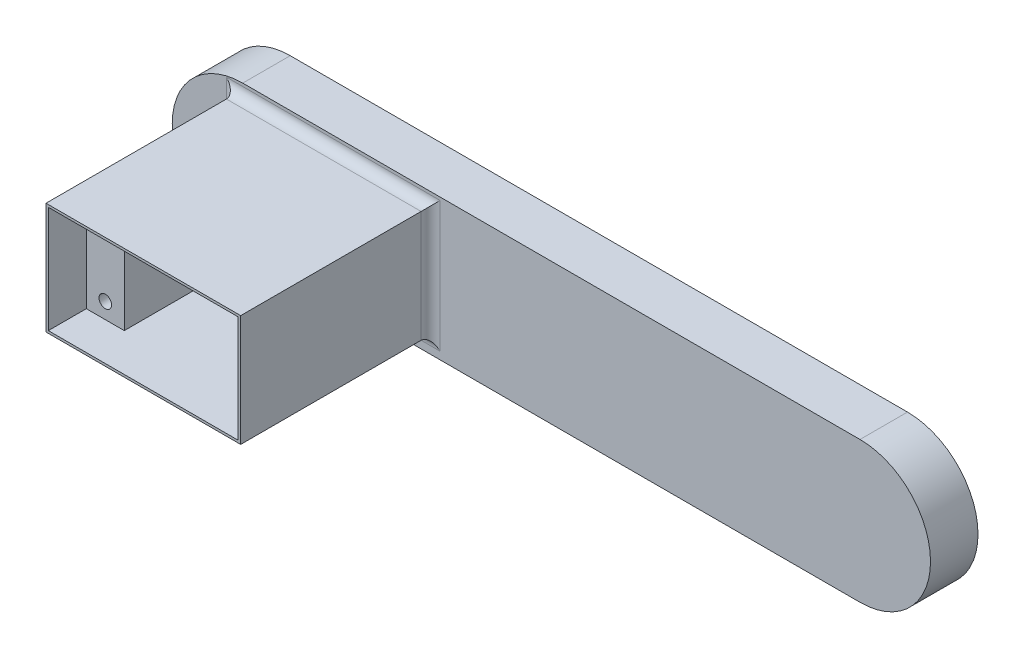
from build123d import *

# Parameters (mm, degrees)
BOSS_EXTRUDE1_DEPTH = 10
SKETCH2_R           = 3.25
CUT_EXTRUDE1_DEPTH  = 6
SKETCH3_W           = 41
SKETCH3_H           = 23.5
SKETCH3_W_2         = 40
SKETCH3_H_2         = 22.5
BOSS_EXTRUDE3_DEPTH = 40
SKETCH4_W           = 7.997138399
SKETCH4_H           = 22.5
SKETCH4_W_2         = 8.001104186
BOSS_EXTRUDE4_DEPTH = 32
SKETCH5_R           = 1.261769867
SKETCH5_R_2         = 1.301986765
SKETCH5_R_3         = 1.319264735
SKETCH5_R_4         = 1.310040981
CUT_EXTRUDE2_DEPTH  = 6
FILLET1_R           = 2


with BuildPart() as part:
    # Sketch1 → Boss-Extrude1 (new body)
    with BuildSketch(Plane.XY):
        with BuildLine():
            Line((-63.656716418, 10.820895522), (66.343283582, 10.820895522))
            ThreePointArc((66.343283582, 10.820895522), (81.194029851, -4.029850746), (66.343283582, -18.880597015))
            Line((66.343283582, -18.880597015), (-63.656716418, -18.880597015))
            ThreePointArc((-63.656716418, -18.880597015), (-78.507462687, -4.029850746), (-63.656716418, 10.820895522))
        make_face()
    extrude(amount=BOSS_EXTRUDE1_DEPTH)

    # Sketch2 → Cut-Extrude1 (cut)
    with BuildSketch(Plane(origin=(0, 0, 0), x_dir=(-1, 0, 0), z_dir=(0, 0, -1))):
        with Locations((-66.343283582, -4.029850746)):
            Circle(SKETCH2_R)
    extrude(amount=-CUT_EXTRUDE1_DEPTH, mode=Mode.SUBTRACT)

    # Sketch3 → Boss-Extrude3 (add)
    with BuildSketch(Plane.XY.offset(10)):
        with Locations((-44.592304464, -3.554480068)):
            Rectangle(SKETCH3_W, SKETCH3_H)
        with Locations((-44.603010247, -3.550272792)):
            Rectangle(SKETCH3_W_2, SKETCH3_H_2, mode=Mode.SUBTRACT)
    extrude(amount=BOSS_EXTRUDE3_DEPTH)

    # Sketch4 → Boss-Extrude4 (add)
    with BuildSketch(Plane.XY.offset(10)):
        with Locations((-60.604441048, -3.550272792)):
            Rectangle(SKETCH4_W, SKETCH4_H)
        with Locations((-28.60356234, -3.550272792)):
            Rectangle(SKETCH4_W_2, SKETCH4_H)
    extrude(amount=BOSS_EXTRUDE4_DEPTH)

    # Sketch5 → Cut-Extrude2 (cut)
    with BuildSketch(Plane.XY.offset(42)):
        with Locations((-60.604441048, 3.806910367)):
            Circle(SKETCH5_R)
        with Locations((-28.60356234, 3.806910367)):
            Circle(SKETCH5_R_2)
        with Locations((-60.604441048, -11.471222054)):
            Circle(SKETCH5_R_3)
        with Locations((-28.60356234, -11.471222054)):
            Circle(SKETCH5_R_4)
    extrude(amount=-CUT_EXTRUDE2_DEPTH, mode=Mode.SUBTRACT)

    # Fillet1
    fillet1_edges = [part.edges().sort_by_distance(p)[0] for p in [
        (-65.092304464, -3.554480068, 10),
        (-44.592304464, -15.304480068, 10),
        (-24.092304464, -3.554480068, 10),
        (-44.592304464, 8.195519932, 10),
        (-44.60499314, 7.699727208, 10),
    ]]
    fillet(fillet1_edges, radius=FILLET1_R)


solid = part.part
